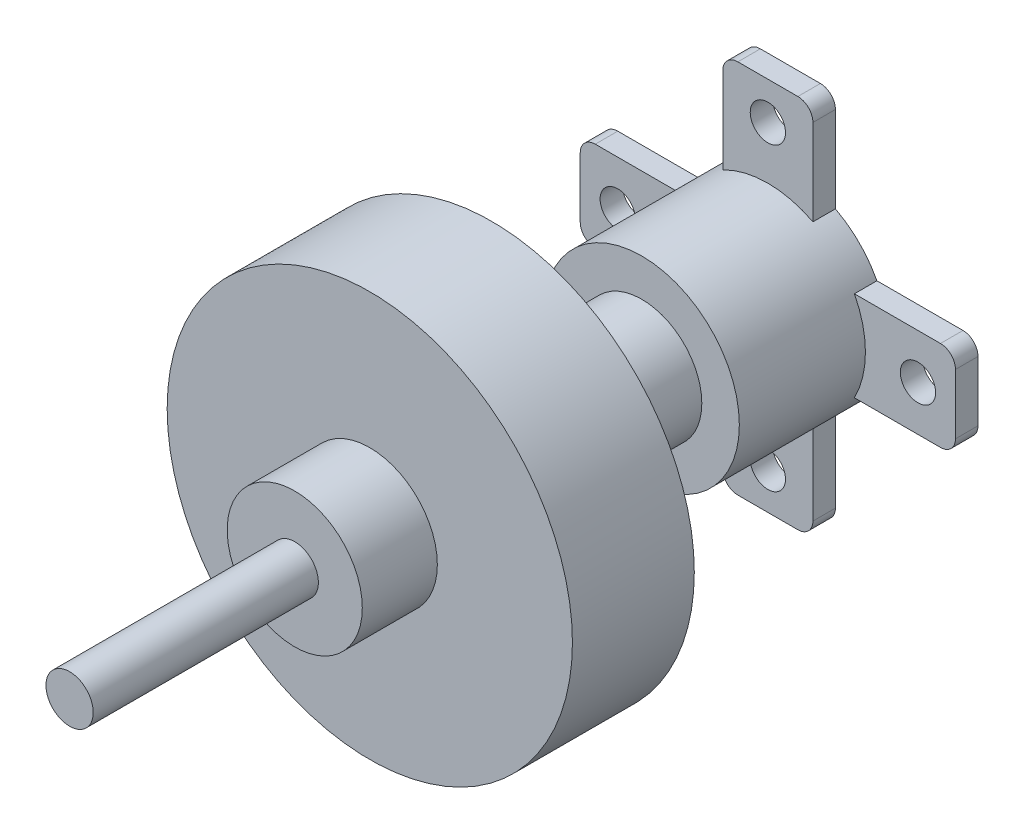
from build123d import *
from build123d.topology import SkipClean

# Parameters (mm, degrees)
CROQUIS1_R              = 6.5
CROQUIS1_R_2            = 4
SALIENTE_EXTRUIR1_DEPTH = 8.4
CROQUIS2_R              = 4
SALIENTE_EXTRUIR2_DEPTH = 10
CROQUIS3_R              = 13.5
SALIENTE_EXTRUIR3_DEPTH = 8.12
CROQUIS4_R              = 4.5
SALIENTE_EXTRUIR4_DEPTH = 5
CROQUIS5_R              = 1.575
SALIENTE_EXTRUIR5_DEPTH = 15
SALIENTE_EXTRUIR6_START = 1.5
CROQUIS6_R              = 1.175
SALIENTE_EXTRUIR6_DEPTH = 1.5


with BuildPart() as part:
    # Croquis1 → Saliente-Extruir1 (new body)
    with BuildSketch(Plane.XY):
        Circle(CROQUIS1_R)
        Circle(CROQUIS1_R_2, mode=Mode.SUBTRACT)
    extrude(amount=SALIENTE_EXTRUIR1_DEPTH)

    # Croquis6 → Saliente-Extruir6 (add)
    with SkipClean():  # the faces are left unmerged after this step: merging them gives an invalid solid
        with BuildSketch(Plane(origin=(0, 0, 0), x_dir=(-1, 0, 0), z_dir=(0, 0, -1)).offset(SALIENTE_EXTRUIR6_START)):
            with BuildLine():
                Line((-2, -12.5), (2, -12.5))
                ThreePointArc((2, -12.5), (2.707106781, -12.207106781), (3, -11.5))
                Line((3, -11.5), (3, -5.766281297))
                ThreePointArc((3, -5.766281297), (4.596194078, -4.596194078), (5.766281297, -3))
                Line((5.766281297, -3), (11.5, -3))
                ThreePointArc((11.5, -3), (12.207106781, -2.707106781), (12.5, -2))
                Line((12.5, -2), (12.5, 2))
                ThreePointArc((12.5, 2), (12.207106781, 2.707106781), (11.5, 3))
                Line((11.5, 3), (5.766281297, 3))
                ThreePointArc((5.766281297, 3), (4.596194078, 4.596194078), (3, 5.766281297))
                Line((3, 5.766281297), (3, 11.5))
                ThreePointArc((3, 11.5), (2.707106781, 12.207106781), (2, 12.5))
                Line((2, 12.5), (-2, 12.5))
                ThreePointArc((-2, 12.5), (-2.707106781, 12.207106781), (-3, 11.5))
                Line((-3, 11.5), (-3, 5.766281297))
                ThreePointArc((-3, 5.766281297), (-4.596194078, 4.596194078), (-5.766281297, 3))
                Line((-5.766281297, 3), (-11.5, 3))
                ThreePointArc((-11.5, 3), (-12.207106781, 2.707106781), (-12.5, 2))
                Line((-12.5, 2), (-12.5, -2))
                ThreePointArc((-12.5, -2), (-12.207106781, -2.707106781), (-11.5, -3))
                Line((-11.5, -3), (-5.766281297, -3))
                ThreePointArc((-5.766281297, -3), (-4.596194078, -4.596194078), (-3, -5.766281297))
                Line((-3, -5.766281297), (-3, -11.5))
                ThreePointArc((-3, -11.5), (-2.707106781, -12.207106781), (-2, -12.5))
            make_face()
            with Locations((0, -10)):
                Circle(CROQUIS6_R, mode=Mode.SUBTRACT)
            with Locations((-10, 0)):
                Circle(CROQUIS6_R, mode=Mode.SUBTRACT)
            with Locations((0, 10)):
                Circle(CROQUIS6_R, mode=Mode.SUBTRACT)
            with Locations((10, 0)):
                Circle(CROQUIS6_R, mode=Mode.SUBTRACT)
        extrude(amount=-SALIENTE_EXTRUIR6_DEPTH)


with BuildPart() as body_2:
    # Croquis2 → Saliente-Extruir2 (new body)
    with BuildSketch(Plane.XY.offset(8.4)):
        Circle(CROQUIS2_R)
    extrude(amount=SALIENTE_EXTRUIR2_DEPTH)

    # Croquis3 → Saliente-Extruir3 (add)
    with BuildSketch(Plane.XY.offset(18.4)):
        Circle(CROQUIS3_R)
    extrude(amount=SALIENTE_EXTRUIR3_DEPTH)

    # Croquis4 → Saliente-Extruir4 (add)
    with BuildSketch(Plane.XY.offset(26.52)):
        Circle(CROQUIS4_R)
    extrude(amount=SALIENTE_EXTRUIR4_DEPTH)

    # Croquis5 → Saliente-Extruir5 (add)
    with BuildSketch(Plane.XY.offset(31.52)):
        Circle(CROQUIS5_R)
    extrude(amount=SALIENTE_EXTRUIR5_DEPTH)


solid = Compound([part.part, body_2.part])
